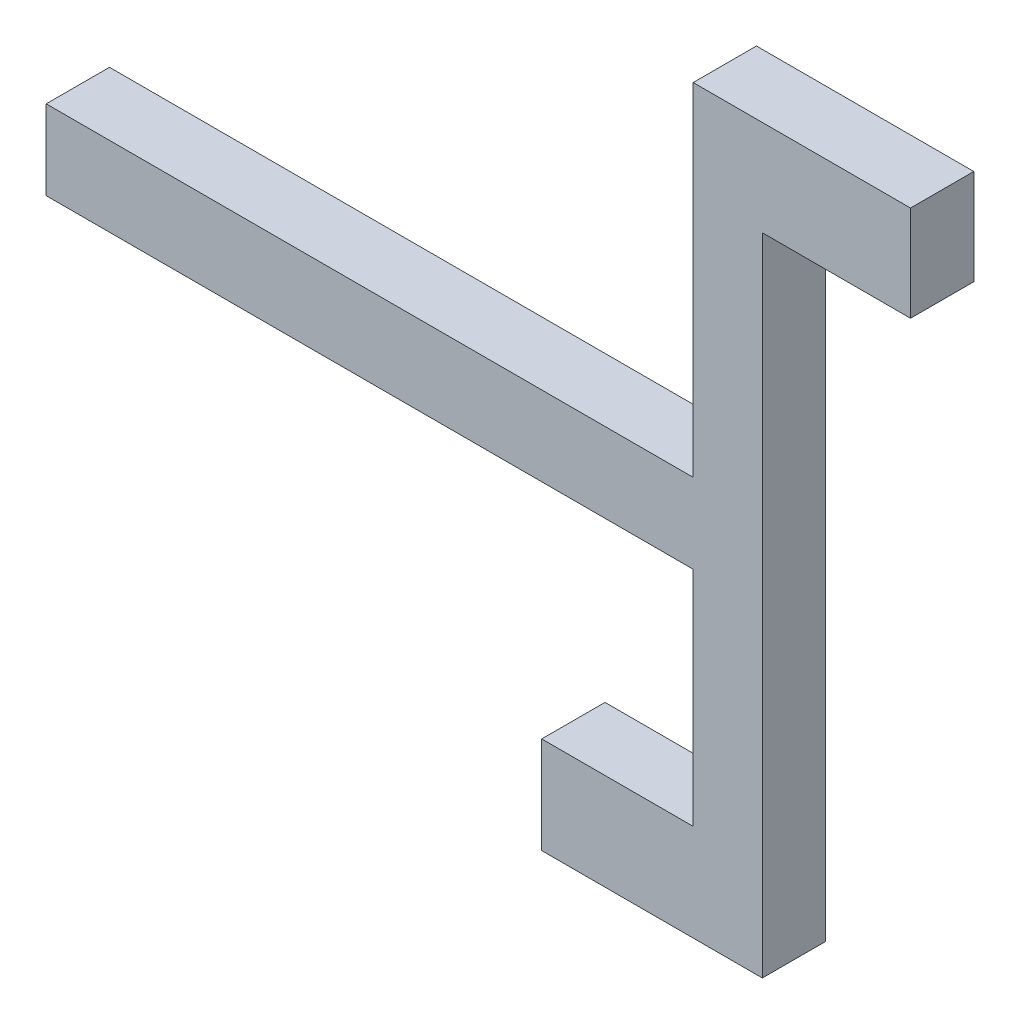
from build123d import *

# Parameters (mm, degrees)
EXTRUDE_1_DEPTH = 30


with BuildPart() as part:
    # Эскиз1 → Бобышка-Вытянуть1 (new body)
    with BuildSketch(Plane.XY):
        Polygon((-31.168048814, 11.789428362), (275.585716028, 11.789428362), (275.585716028, 173.911027101), (378.632439589, 173.911027101), (378.632439589, 128.632921293), (308.373309888, 128.632921293), (308.373309888, -177.384621404), (203.765272334, -177.384621404), (203.765272334, -131.52026862), (275.585716028, -131.52026862), (275.585716028, -25.937164048), (-31.168048814, -25.937164048), align=None)
    extrude(amount=EXTRUDE_1_DEPTH)


solid = part.part
